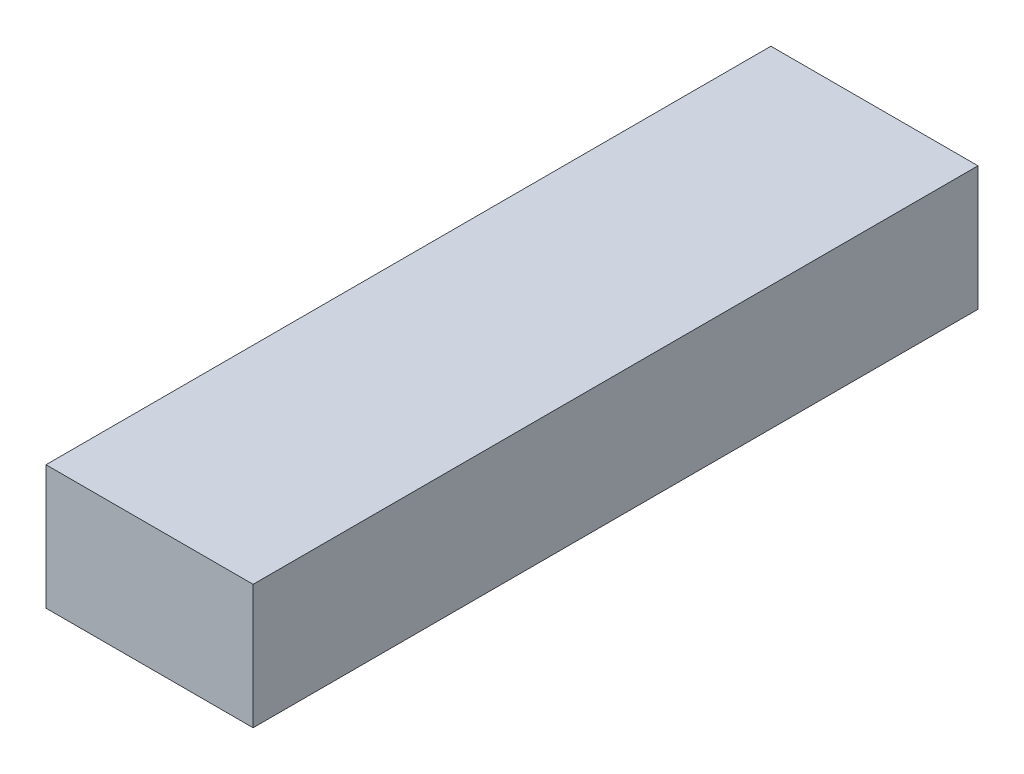
from build123d import *

# Parameters (mm, degrees)
SKIZZE1_W                       = 100
SKIZZE1_H                       = 60
AUFSATZ_LINEAR_AUSTRAGEN1_DEPTH = 175


with BuildPart() as part:
    # Skizze1 → Aufsatz-Linear austragen1 (new, symmetric)
    with BuildSketch(Plane.XY):
        Rectangle(SKIZZE1_W, SKIZZE1_H)
    extrude(amount=AUFSATZ_LINEAR_AUSTRAGEN1_DEPTH, both=True)


solid = part.part
